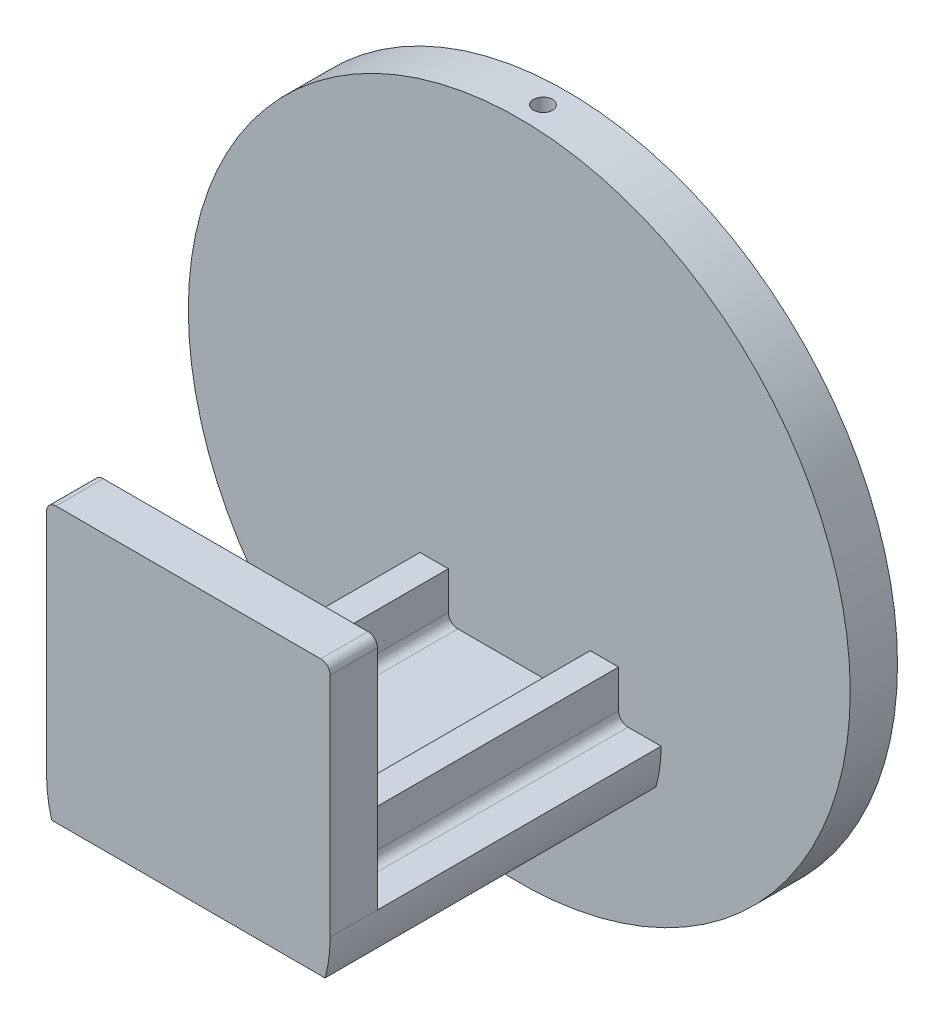
from build123d import *

# Parameters (mm, degrees)
SKETCH1_R               = 35
BOSS_EXTRUDE1_DEPTH     = 5
BOSS_EXTRUDE2_DEPTH     = 35
SKETCH3_W               = 30
SKETCH3_H               = 5
BOSS_EXTRUDE3_DEPTH     = 25
SKETCH4_W               = 3
SKETCH4_H               = 30
BOSS_EXTRUDE5_DEPTH     = 5
CUT_EXTRUDE1_DEPTH      = 38
CUT_EXTRUDE1_DEPTH_BACK = 61.621778265
SKETCH5_R               = 1
FILLET1_R               = 1
FILLET2_R               = 1
FILLET3_R               = 1
CUT_EXTRUDE2_REACH      = 65.64
CUT_EXTRUDE2_END_RADIUS = 1
SKETCH6_R               = 0.5


with BuildPart() as part:
    # Sketch1 → Boss-Extrude1 (new body)
    with BuildSketch(Plane.XY):
        Circle(SKETCH1_R)
    extrude(amount=-BOSS_EXTRUDE1_DEPTH)

    # Sketch2 → Boss-Extrude2 (add)
    with BuildSketch(Plane.XY):
        with BuildLine():
            Line((-15, -15), (15, -15))
            ThreePointArc((15, -15), (14.863587797, -17.018355219), (14.456832295, -19))
            Line((14.456832295, -19), (-14.456832295, -19))
            ThreePointArc((-14.456832295, -19), (-14.863587797, -17.018355219), (-15, -15))
        make_face()
    extrude(amount=BOSS_EXTRUDE2_DEPTH)

    # Sketch3 → Boss-Extrude3 (add)
    with BuildSketch(Plane(origin=(0, -15, 0), x_dir=(1, 0, 0), z_dir=(0, 1, 0))):
        with Locations((0, -32.5)):
            Rectangle(SKETCH3_W, SKETCH3_H)
    extrude(amount=BOSS_EXTRUDE3_DEPTH)

    # Sketch4 → Boss-Extrude5 (add)
    with BuildSketch(Plane(origin=(0, -15, 0), x_dir=(1, 0, 0), z_dir=(0, 1, 0))):
        with Locations((9, -15)):
            Rectangle(SKETCH4_W, SKETCH4_H)
        with Locations((-9, -15)):
            Rectangle(SKETCH4_W, SKETCH4_H)
    extrude(amount=BOSS_EXTRUDE5_DEPTH)

    # Sketch5 → Cut-Extrude1 (cut, two sides: drawn at the far end of the back side and taken through both)
    with BuildSketch(Plane(origin=(0, 0, 0), x_dir=(1, 0, 0), z_dir=(0, 1, 0)).offset(-CUT_EXTRUDE1_DEPTH_BACK)):
        with Locations(Location((0, 2.5, 0), (0, 0, 90))):
            Circle(SKETCH5_R)
    extrude(amount=CUT_EXTRUDE1_DEPTH + CUT_EXTRUDE1_DEPTH_BACK, mode=Mode.SUBTRACT)

    # Fillet1
    fillet1_edges = [part.edges().sort_by_distance(p)[0] for p in [
        (15, 10, 32.5),
        (-15, 10, 32.5),
    ]]
    fillet(fillet1_edges, radius=FILLET1_R)

    # Fillet2
    fillet2_edges = [part.edges().sort_by_distance(p)[0] for p in [
        (7.5, -15, 15),
        (-7.5, -15, 15),
    ]]
    fillet(fillet2_edges, radius=FILLET2_R)

    # Fillet3
    fillet3_edges = [part.edges().sort_by_distance(p)[0] for p in [
        (10.5, -15, 15),
        (-10.5, -15, 15),
    ]]
    fillet(fillet3_edges, radius=FILLET3_R)

    # Cut-Extrude2: up to this cylinder (the profile starts outside it)
    cut_extrude2_end = Plane(origin=(0, 0, -2.5), z_dir=(0, -1, 0)) * Cylinder(CUT_EXTRUDE2_END_RADIUS, 156.28, mode=Mode.PRIVATE)
    # Sketch6 → Cut-Extrude2 (cut, up to the surface)
    with BuildSketch(Plane(origin=(0, 0, -5), x_dir=(-1, 0, 0), z_dir=(0, 0, -1)), mode=Mode.PRIVATE) as cut_extrude2_sk1:
        with Locations((0, 11)):
            Circle(SKETCH6_R)
    cut_extrude2_tool1 = extrude(cut_extrude2_sk1.sketch, amount=-CUT_EXTRUDE2_REACH, mode=Mode.PRIVATE) - cut_extrude2_end
    add(cut_extrude2_tool1.solids().sort_by_distance((0, 11, -5))[0], mode=Mode.SUBTRACT)
    # Sketch6 → Cut-Extrude2 (cut, up to the surface)
    with BuildSketch(Plane(origin=(0, 0, -5), x_dir=(-1, 0, 0), z_dir=(0, 0, -1)), mode=Mode.PRIVATE) as cut_extrude2_sk2:
        with Locations((0, -11)):
            Circle(SKETCH6_R)
    cut_extrude2_tool2 = extrude(cut_extrude2_sk2.sketch, amount=-CUT_EXTRUDE2_REACH, mode=Mode.PRIVATE) - cut_extrude2_end
    add(cut_extrude2_tool2.solids().sort_by_distance((0, -11, -5))[0], mode=Mode.SUBTRACT)


solid = part.part
